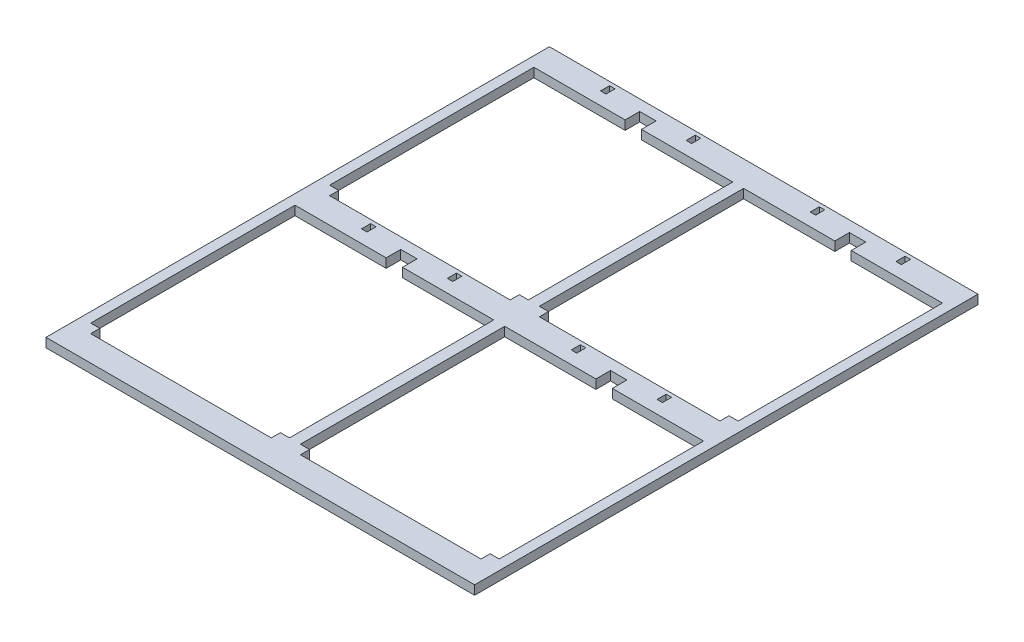
from build123d import *

# Parameters (mm, degrees)
SKETCH1_W                 = 120
SKETCH1_H                 = 145
SKETCH1_W_2               = 109
SKETCH1_H_2               = 117
BOSS_EXTRUDE1_DEPTH       = 5
CUT_EXTRUDE1_DEPTH        = 10
SKETCH5_W                 = 3
SKETCH5_H                 = 5
CUT_EXTRUDE4_DEPTH        = 95.240384125
SKETCH6_W                 = 5
SKETCH6_H                 = 5
BOSS_EXTRUDE2_DEPTH       = 5
LPATTERN1_COUNT           = 2
LPATTERN1_PITCH           = 115
LPATTERN1_COUNT_DIR2      = 2
LPATTERN1_PITCH_DIR2      = 131
LPATTERN1_COPY_1_SKETCH_W = 3
LPATTERN1_COPY_1_SKETCH_H = 5
LPATTERN1_COPY_1_DEPTH    = 95.240384125
LPATTERN1_COPY_2_SKETCH_W = 3
LPATTERN1_COPY_2_SKETCH_H = 5
LPATTERN1_COPY_2_DEPTH    = 95.240384125
LPATTERN1_COPY_3_SKETCH_W = 3
LPATTERN1_COPY_3_SKETCH_H = 5
LPATTERN1_COPY_3_DEPTH    = 95.240384125
LPATTERN1_COPY_4_SKETCH_W = 5
LPATTERN1_COPY_4_SKETCH_H = 5
LPATTERN1_COPY_4_DEPTH    = 5
LPATTERN1_COPY_5_SKETCH_W = 5
LPATTERN1_COPY_5_SKETCH_H = 5
LPATTERN1_COPY_5_DEPTH    = 5
LPATTERN1_COPY_6_SKETCH_W = 5
LPATTERN1_COPY_6_SKETCH_H = 5
LPATTERN1_COPY_6_DEPTH    = 5


with BuildPart() as part:
    # Sketch1 → Boss-Extrude1 (new body)
    with BuildSketch(Plane(origin=(0, 0, 0), x_dir=(1, 0, 0), z_dir=(0, 1, 0))):
        Rectangle(SKETCH1_W, SKETCH1_H)
        Rectangle(SKETCH1_W_2, SKETCH1_H_2, mode=Mode.SUBTRACT)
    boss_extrude1 = extrude(amount=BOSS_EXTRUDE1_DEPTH)

    # Sketch2 → Cut-Extrude1 (cut)
    with BuildSketch(Plane(origin=(0, 5, 0), x_dir=(1, 0, 0), z_dir=(0, 1, 0))):
        Polygon((-4.5, 58.5), (0, 58.5), (4.5, 58.5), (4.5, 66.5), (-4.5, 66.5), align=None)
    cut_extrude1 = extrude(amount=-CUT_EXTRUDE1_DEPTH, mode=Mode.SUBTRACT)

    # Sketch5 → Cut-Extrude4 (cut, through all)
    with BuildSketch(Plane(origin=(0, 5, 0), x_dir=(1, 0, 0), z_dir=(0, 1, 0))):
        with Locations((-23.5, 68)):
            Rectangle(SKETCH5_W, SKETCH5_H)
    cut_extrude4 = extrude(amount=-CUT_EXTRUDE4_DEPTH, mode=Mode.SUBTRACT)

    # Mirror1: Cut-Extrude4 across plane
    add(cut_extrude4.mirror(Plane(origin=(0, 0, 0), x_dir=(0, 0, 1), z_dir=(1, 0, 0))), mode=Mode.SUBTRACT)

    # Sketch6 → Boss-Extrude2 (add)
    with BuildSketch(Plane(origin=(0, 5, 0), x_dir=(1, 0, 0), z_dir=(0, 1, 0))):
        with Locations((52, -56)):
            Rectangle(SKETCH6_W, SKETCH6_H)
    boss_extrude2 = extrude(amount=-BOSS_EXTRUDE2_DEPTH)

    # Mirror2: Boss-Extrude2 across plane
    add(boss_extrude2.mirror(Plane(origin=(0, 0, 0), x_dir=(0, 0, 1), z_dir=(1, 0, 0))))

    # LPattern1: Boss-Extrude1, Cut-Extrude1, Cut-Extrude4, Boss-Extrude2 2 × 2
    with Locations(*[(i * LPATTERN1_PITCH, 0, j * LPATTERN1_PITCH_DIR2) for i in range(LPATTERN1_COUNT) for j in range(LPATTERN1_COUNT_DIR2) if (i, j) != (0, 0)]):
        add(boss_extrude1)
        add(cut_extrude1, mode=Mode.SUBTRACT)
        add(cut_extrude4, mode=Mode.SUBTRACT)
        add(boss_extrude2)

    # LPattern1 copy 1 sketch → LPattern1 copy 1 (cut, through all)
    with BuildSketch(Plane(origin=(0, 5, 131), x_dir=(-1, 0, 0), z_dir=(0, 1, 0))):
        with Locations((-23.5, -68)):
            Rectangle(LPATTERN1_COPY_1_SKETCH_W, LPATTERN1_COPY_1_SKETCH_H)
    extrude(amount=-LPATTERN1_COPY_1_DEPTH, mode=Mode.SUBTRACT)

    # LPattern1 copy 2 sketch → LPattern1 copy 2 (cut, through all)
    with BuildSketch(Plane(origin=(115, 5, 0), x_dir=(-1, 0, 0), z_dir=(0, 1, 0))):
        with Locations((-23.5, -68)):
            Rectangle(LPATTERN1_COPY_2_SKETCH_W, LPATTERN1_COPY_2_SKETCH_H)
    extrude(amount=-LPATTERN1_COPY_2_DEPTH, mode=Mode.SUBTRACT)

    # LPattern1 copy 3 sketch → LPattern1 copy 3 (cut, through all)
    with BuildSketch(Plane(origin=(115, 5, 131), x_dir=(-1, 0, 0), z_dir=(0, 1, 0))):
        with Locations((-23.5, -68)):
            Rectangle(LPATTERN1_COPY_3_SKETCH_W, LPATTERN1_COPY_3_SKETCH_H)
    extrude(amount=-LPATTERN1_COPY_3_DEPTH, mode=Mode.SUBTRACT)

    # LPattern1 copy 4 sketch → LPattern1 copy 4 (add)
    with BuildSketch(Plane(origin=(0, 5, 131), x_dir=(-1, 0, 0), z_dir=(0, 1, 0))):
        with Locations((52, 56)):
            Rectangle(LPATTERN1_COPY_4_SKETCH_W, LPATTERN1_COPY_4_SKETCH_H)
    extrude(amount=-LPATTERN1_COPY_4_DEPTH)

    # LPattern1 copy 5 sketch → LPattern1 copy 5 (add)
    with BuildSketch(Plane(origin=(115, 5, 0), x_dir=(-1, 0, 0), z_dir=(0, 1, 0))):
        with Locations((52, 56)):
            Rectangle(LPATTERN1_COPY_5_SKETCH_W, LPATTERN1_COPY_5_SKETCH_H)
    extrude(amount=-LPATTERN1_COPY_5_DEPTH)

    # LPattern1 copy 6 sketch → LPattern1 copy 6 (add)
    with BuildSketch(Plane(origin=(115, 5, 131), x_dir=(-1, 0, 0), z_dir=(0, 1, 0))):
        with Locations((52, 56)):
            Rectangle(LPATTERN1_COPY_6_SKETCH_W, LPATTERN1_COPY_6_SKETCH_H)
    extrude(amount=-LPATTERN1_COPY_6_DEPTH)


solid = part.part
